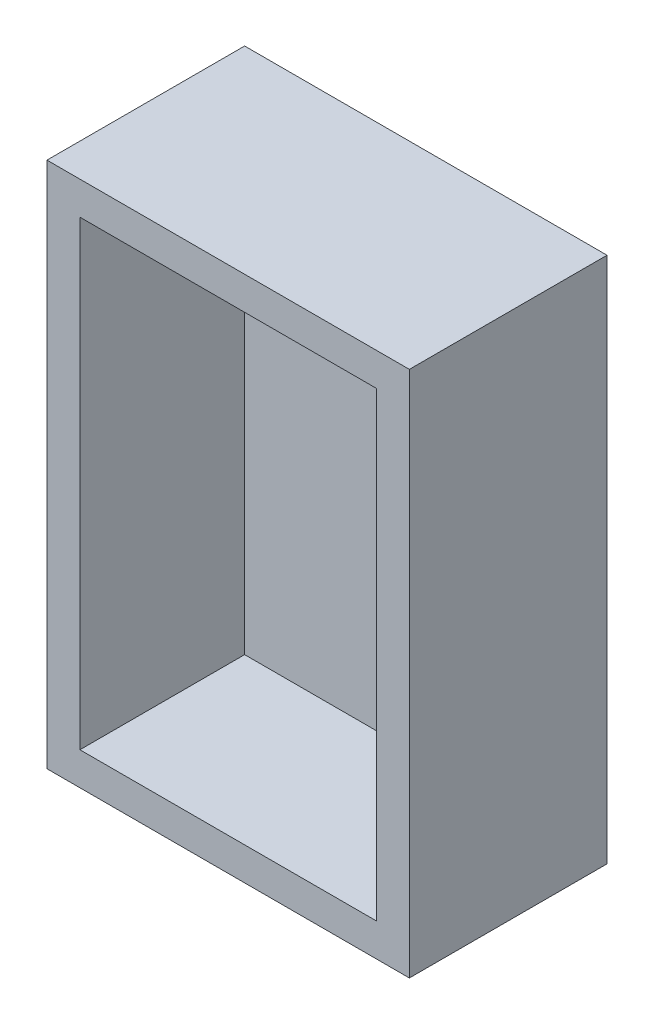
from build123d import *

# Parameters (mm, degrees)
BOSS_EXTRUDE1_START = -6
SKETCH1_W           = 22
SKETCH1_H           = 32
BOSS_EXTRUDE1_DEPTH = 12
BOSS_EXTRUDE2_START = -4
SKETCH2_W           = 18
SKETCH2_H           = 28
BOSS_EXTRUDE2_DEPTH = 11


with BuildPart() as part:
    # Sketch1 → Boss-Extrude1 (new body)
    with BuildSketch(Plane.XY.offset(BOSS_EXTRUDE1_START)):
        with Locations((0, 16)):
            Rectangle(SKETCH1_W, SKETCH1_H)
    extrude(amount=BOSS_EXTRUDE1_DEPTH)


with BuildPart() as body_2:
    # Sketch2 → Boss-Extrude2 (new body)
    with BuildSketch(Plane.XY.offset(BOSS_EXTRUDE2_START)):
        with Locations((0, 16)):
            Rectangle(SKETCH2_W, SKETCH2_H)
    extrude(amount=BOSS_EXTRUDE2_DEPTH)


with BuildPart() as part_1:
    add(part.part)

    # Combine1: cut body 2
    add(body_2.part, mode=Mode.SUBTRACT)


solid = part_1.part
